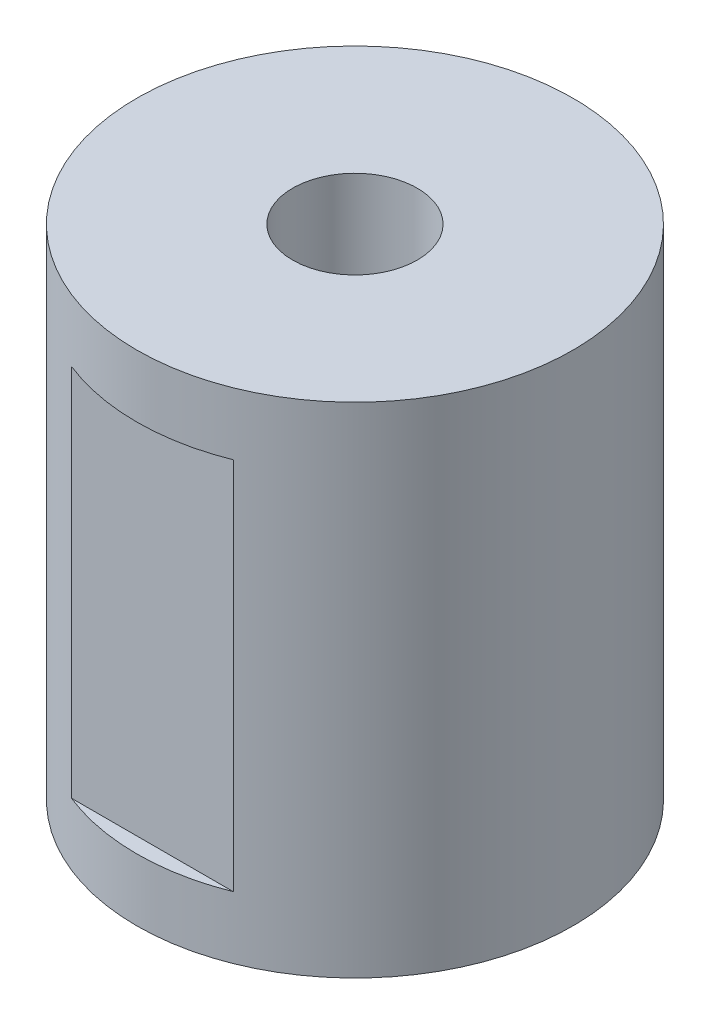
from build123d import *

# Parameters (mm, degrees)
SKETCH1_R           = 35000
BOSS_EXTRUDE1_DEPTH = 80000
SKETCH2_R           = 10000
CUT_EXTRUDE1_DEPTH  = 94075.438611134
SKETCH3_W           = 25980
SKETCH3_H           = 60000
CUT_EXTRUDE2_DEPTH  = 2500
SKETCH4_W           = 36060
SKETCH4_H           = 40000
CUT_EXTRUDE3_DEPTH  = 5000


with BuildPart() as part:
    # Sketch1 → Boss-Extrude1 (new body)
    with BuildSketch(Plane(origin=(0, 0, 0), x_dir=(1, 0, 0), z_dir=(0, 1, 0))):
        Circle(SKETCH1_R)
    extrude(amount=BOSS_EXTRUDE1_DEPTH)

    # Sketch2 → Cut-Extrude1 (cut, through all)
    with BuildSketch(Plane(origin=(0, 80000, 0), x_dir=(1, 0, 0), z_dir=(0, 1, 0))):
        Circle(SKETCH2_R)
    extrude(amount=-CUT_EXTRUDE1_DEPTH, mode=Mode.SUBTRACT)

    # Sketch3 → Cut-Extrude2 (cut)
    with BuildSketch(Plane.XY.offset(35000)):
        with Locations((0, 40000)):
            Rectangle(SKETCH3_W, SKETCH3_H)
    extrude(amount=-CUT_EXTRUDE2_DEPTH, mode=Mode.SUBTRACT)

    # Sketch4 → Cut-Extrude3 (cut)
    with BuildSketch(Plane.ZY.offset(35000)):
        with Locations((0, 40000)):
            Rectangle(SKETCH4_W, SKETCH4_H)
    extrude(amount=-CUT_EXTRUDE3_DEPTH, mode=Mode.SUBTRACT)


solid = part.part
